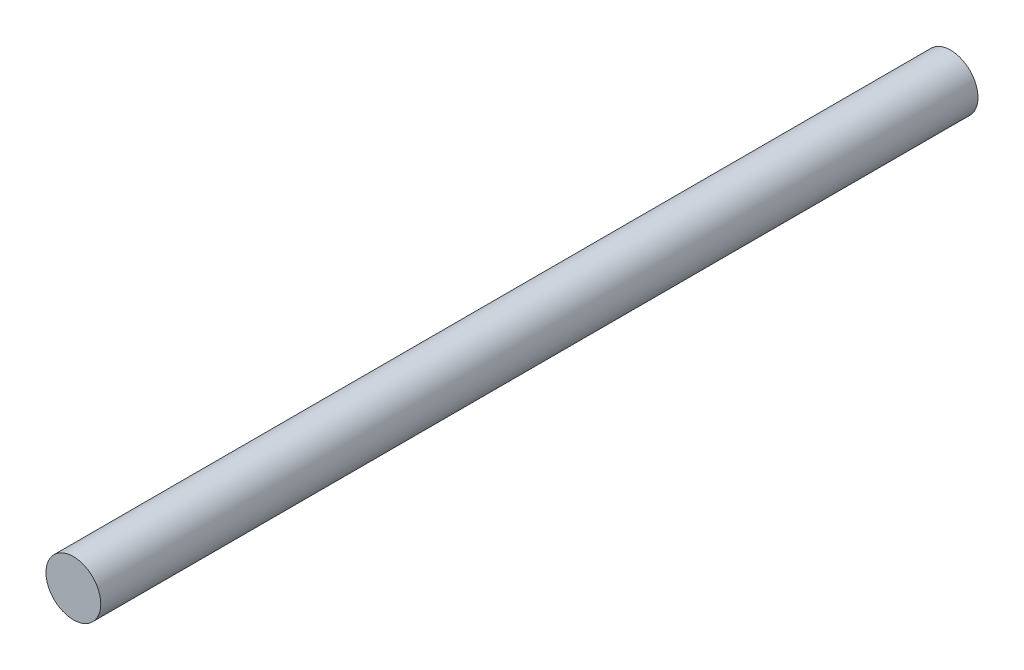
from build123d import *

# Parameters (mm, degrees)
SKETCH1_R           = 1
BOSS_EXTRUDE1_DEPTH = 32


with BuildPart() as part:
    # Sketch1 → Boss-Extrude1 (new body)
    with BuildSketch(Plane.XY):
        Circle(SKETCH1_R)
    extrude(amount=BOSS_EXTRUDE1_DEPTH)


solid = part.part
